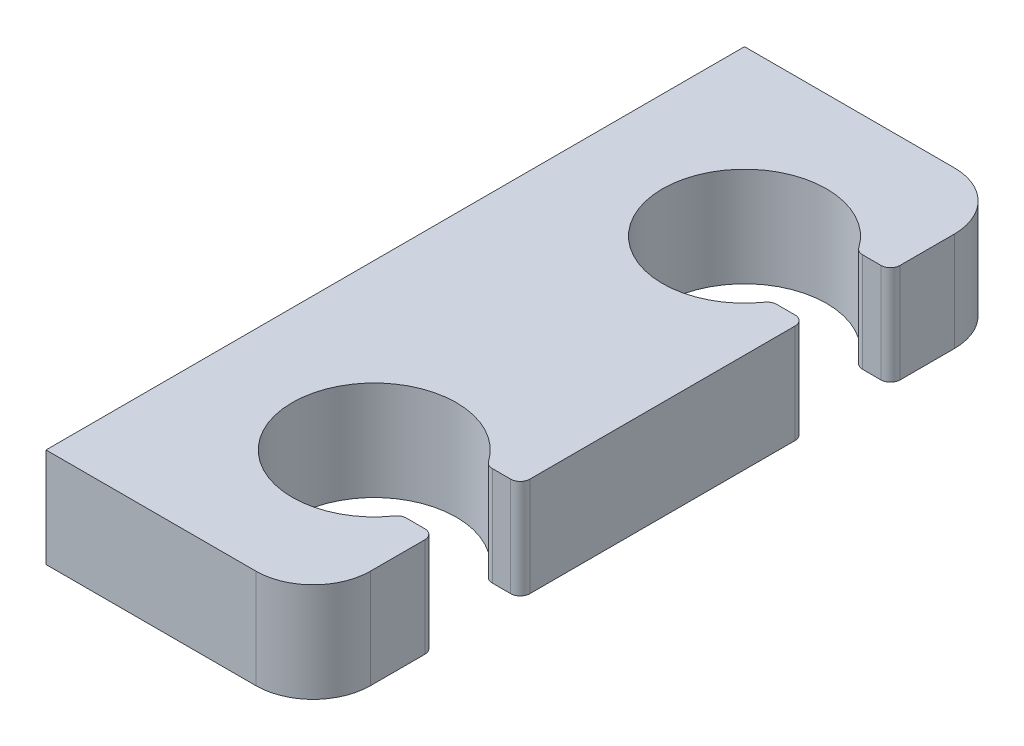
from build123d import *

# Parameters (mm, degrees)
CROQUIS1_W              = 7
CROQUIS1_H              = 18.3
SALIENTE_EXTRUIR1_DEPTH = 2.6
CORTAR_EXTRUIR2_DEPTH   = 10
REDONDEO1_R             = 1.5


with BuildPart() as part:
    # Croquis1 → Saliente-Extruir1 (new body)
    with BuildSketch(Plane(origin=(0, 0, 0), x_dir=(1, 0, 0), z_dir=(0, 1, 0))):
        Rectangle(CROQUIS1_W, CROQUIS1_H)
    extrude(amount=SALIENTE_EXTRUIR1_DEPTH)

    # Croquis2 → Cortar-Extruir2 (cut)
    with BuildSketch(Plane(origin=(0, 2.6, 0), x_dir=(1, 0, 0), z_dir=(0, 1, 0))):
        with BuildLine():
            ThreePointArc((3.25, 3.725), (3.426776695, 3.651776695), (3.5, 3.475))
            Line((3.5, 3.475), (3.5, 6.225))
            ThreePointArc((3.5, 6.225), (3.426776695, 6.048223305), (3.25, 5.975))
            Line((3.25, 5.975), (2.767072698, 5.975))
            ThreePointArc((2.767072698, 5.975), (2.651546276, 6.003293785), (2.562169292, 6.081770833))
            ThreePointArc((2.562169292, 6.081770833), (-1.35, 4.85), (2.562169292, 3.618229167))
            ThreePointArc((2.562169292, 3.618229167), (2.651546276, 3.696706215), (2.767072698, 3.725))
            Line((2.767072698, 3.725), (3.25, 3.725))
        make_face()
        with BuildLine():
            ThreePointArc((3.5, -3.475), (3.426776695, -3.651776695), (3.25, -3.725))
            Line((3.25, -3.725), (2.767072698, -3.725))
            ThreePointArc((2.767072698, -3.725), (2.651546276, -3.696706215), (2.562169292, -3.618229167))
            ThreePointArc((2.562169292, -3.618229167), (-1.35, -4.85), (2.562169292, -6.081770833))
            ThreePointArc((2.562169292, -6.081770833), (2.651546276, -6.003293785), (2.767072698, -5.975))
            Line((2.767072698, -5.975), (3.25, -5.975))
            ThreePointArc((3.25, -5.975), (3.426776695, -6.048223305), (3.5, -6.225))
            Line((3.5, -6.225), (3.5, -3.475))
        make_face()
    extrude(amount=-CORTAR_EXTRUIR2_DEPTH, mode=Mode.SUBTRACT)

    # Redondeo1
    redondeo1_edges = [part.edges().sort_by_distance(p)[0] for p in [
        (3.5, 1.3, 9.15),
        (3.5, 1.3, -9.15),
    ]]
    fillet(redondeo1_edges, radius=REDONDEO1_R)


solid = part.part
